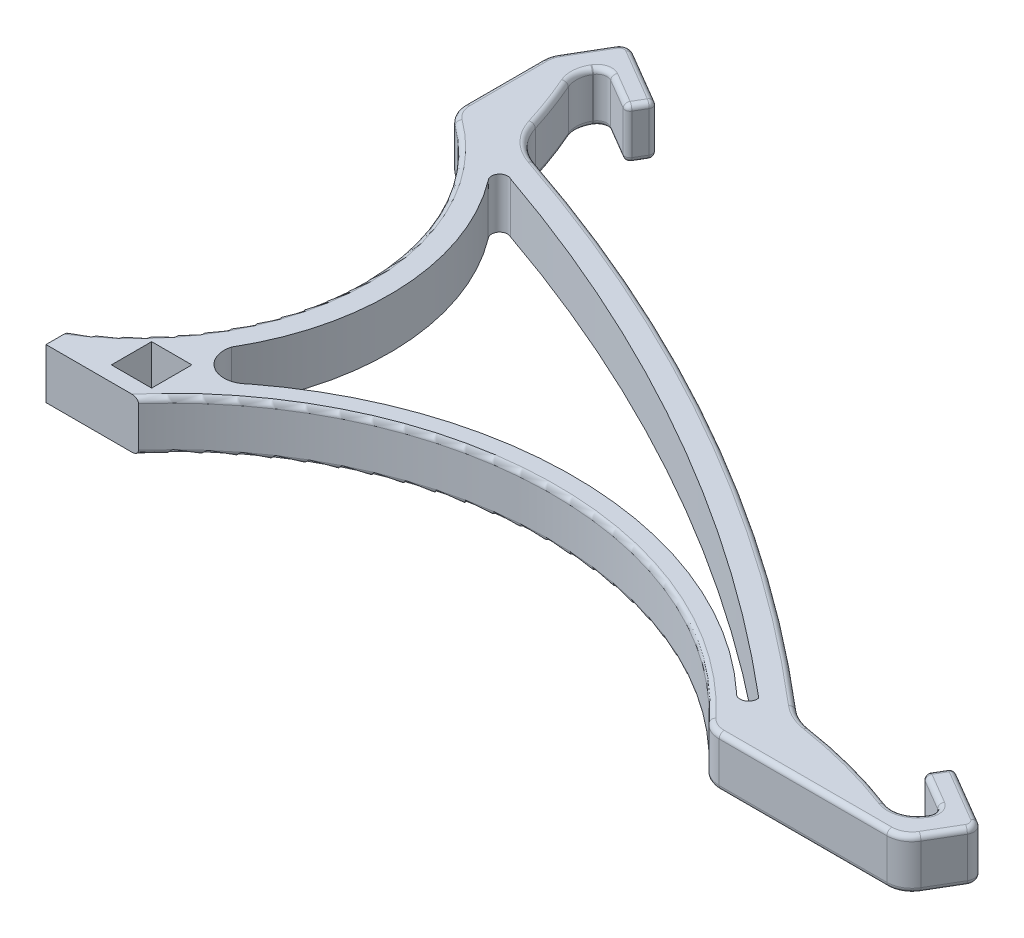
from build123d import *

# Parameters (mm, degrees)
BOSS_EXTRUDE1_DEPTH = 10
CUT_EXTRUDE1_DEPTH  = 103.530483272
BOSS_EXTRUDE3_DEPTH = 10
FILLET1_R           = 5
FILLET3_R           = 100
SKETCH4_W           = 8
SKETCH4_H           = 8
CUT_EXTRUDE2_DEPTH  = 112.808929726
FILLET4_R           = 1


with BuildPart() as part:
    # Sketch1 → Boss-Extrude1 (new body)
    with BuildSketch(Plane(origin=(0, 0, 0), x_dir=(1, 0, 0), z_dir=(0, 1, 0))):
        Polygon((-82.5, 52.5), (87.5, -47.5), (-82.5, -47.5), align=None)
    extrude(amount=BOSS_EXTRUDE1_DEPTH)

    # Sketch2 → Cut-Extrude1 (cut, through all)
    with BuildSketch(Plane(origin=(0, 10, 0), x_dir=(1, 0, 0), z_dir=(0, 1, 0))):
        with BuildLine():
            Line((-72.5, 46.617647059), (-72.5, 42.260960752))
            ThreePointArc((-72.5, 42.260960752), (-70.618090153, 36.4217303), (-65.680677547, 32.780280905))
            ThreePointArc((-65.680677547, 32.780280905), (-2.520146886, 4.604537561), (54.110121843, -35.096064577))
            ThreePointArc((54.110121843, -35.096064577), (57.142265209, -36.875274781), (60.602790692, -37.495150349))
            Line((60.602790692, -37.495150349), (70.50100103, -37.500588841))
            Line((70.50100103, -37.500588841), (-72.5, 46.617647059))
        make_face()
        with BuildLine():
            Line((49.112101066, -47.5), (-64.112101066, -47.5))
            ThreePointArc((-64.112101066, -47.5), (-7.5, -21.969013067), (49.112101066, -47.5))
        make_face()
        with BuildLine():
            Line((-82.5, -42.73498027), (-82.5, 33.203647439))
            ThreePointArc((-82.5, 33.203647439), (-62.03937094, -4.765666416), (-82.5, -42.73498027))
        make_face()
        with BuildLine():
            ThreePointArc((-55.606776415, -34.161786787), (-61.444525444, -34.944277204), (-63.616791683, -29.469529322))
            ThreePointArc((-63.616791683, -29.469529322), (-56.998023123, -1.896976683), (-66.802364381, 24.709951902))
            ThreePointArc((-66.802364381, 24.709951902), (-66.900578229, 26.780603411), (-64.870749624, 27.201363987))
            ThreePointArc((-64.870749624, 27.201363987), (-4.844619061, 0.148849816), (49.174432211, -37.493107799))
            ThreePointArc((49.174432211, -37.493107799), (48.229175402, -39.403304985), (46.162007191, -38.884480053))
            ThreePointArc((46.162007191, -38.884480053), (-3.854303198, -17.816945122), (-55.606776415, -34.161786787))
        make_face()
    extrude(amount=-CUT_EXTRUDE1_DEPTH, mode=Mode.SUBTRACT)

    # Sketch3 → Boss-Extrude3 (add, through all)
    with BuildSketch(Plane(origin=(0, 10, 0), x_dir=(1, 0, 0), z_dir=(0, 1, 0))):
        with BuildLine():
            Line((87.5, -47.5), (92.367393215, -39.225431534))
            ThreePointArc((92.367393215, -39.225431534), (92.579518581, -37.709466964), (91.657565038, -36.487522851))
            Line((91.657565038, -36.487522851), (81.314354456, -30.403281332))
            ThreePointArc((81.314354456, -30.403281332), (80.556372171, -30.297218649), (79.945400114, -30.758195421))
            Line((79.945400114, -30.758195421), (78.677849798, -32.913030959))
            ThreePointArc((78.677849798, -32.913030959), (78.571787115, -33.671013244), (79.032763886, -34.2819853))
            Line((79.032763886, -34.2819853), (85.066303392, -37.831126186))
            ThreePointArc((85.066303392, -37.831126186), (85.988256936, -39.053070299), (85.77613157, -40.56903487))
            Line((85.77613157, -40.56903487), (83.190328924, -44.964899367))
            Line((83.190328924, -44.964899367), (87.5, -47.5))
        make_face()
        with BuildLine():
            Line((-82.5, 52.5), (-77.613319152, 60.807357441))
            ThreePointArc((-77.613319152, 60.807357441), (-76.391375039, 61.729310984), (-74.875410469, 61.517185618))
            Line((-74.875410469, 61.517185618), (-64.532199887, 55.4329441))
            ThreePointArc((-64.532199887, 55.4329441), (-64.071223115, 54.821972043), (-64.177285798, 54.063989758))
            Line((-64.177285798, 54.063989758), (-65.444836115, 51.90915422))
            ThreePointArc((-65.444836115, 51.90915422), (-66.055808171, 51.448177448), (-66.813790456, 51.554240131))
            Line((-66.813790456, 51.554240131), (-72.847329962, 55.103381017))
            ThreePointArc((-72.847329962, 55.103381017), (-74.363294533, 55.315506383), (-75.585238646, 54.39355284))
            Line((-75.585238646, 54.39355284), (-78.190328924, 49.964899367))
            Line((-78.190328924, 49.964899367), (-82.5, 52.5))
        make_face()
    extrude(amount=-BOSS_EXTRUDE3_DEPTH)

    # Fillet1
    fillet1_edges = [part.edges().sort_by_distance(p)[0] for p in [
        (49.112101066, 5, 47.5),
        (-82.5, 5, -33.203647439),
        (-82.5, 5, -52.5),
        (87.5, 5, 47.5),
        (83.190328924, 5, 44.964899367),
        (-78.190328924, 5, -49.964899367),
    ]]
    fillet(fillet1_edges, radius=FILLET1_R)

    # Fillet3
    fillet3_edges = [part.edges().sort_by_distance(p)[0] for p in [
        (-72.5, 5, -46.617647059),
        (70.50100103, 5, 37.500588841),
    ]]
    fillet(fillet3_edges, radius=FILLET3_R)

    # Sketch4 → Cut-Extrude2 (cut, through all)
    with BuildSketch(Plane(origin=(0, 10, 0), x_dir=(1, 0, 0), z_dir=(0, 1, 0))):
        with Locations((-68.5, -40.5)):
            Rectangle(SKETCH4_W, SKETCH4_H)
    extrude(amount=-CUT_EXTRUDE2_DEPTH, mode=Mode.SUBTRACT)

    # Fillet4
    fillet4_edges = [part.edges().sort_by_distance(p)[0] for p in [
        (-74.363294533, 10, -55.315506383),
        (-69.830560209, 10, -53.328810574),
        (-64.811060956, 10, -52.986571989),
        (-69.703805178, 10, -58.475064859),
        (-76.391375039, 10, -61.729310984),
        (-79.711495114, 10, -57.240458306),
        (-82.5, 0, -43.473553854),
        (-82.5, 10, -43.473553854),
        (-75.620233469, 10, -54.334061642),
        (-8.570971136, 10, 21.976606221),
        (67.982036607, 10, 47.5),
        (90.65866701, 10, 42.130266084),
        (87.122657373, 10, 46.840247871),
        (49.333096697, 10, 47.086620377),
        (-82.324331839, 10, -52.452164103),
        (-81.964474926, 10, -33.557324308),
        (90.65866701, 0, 42.130266084),
        (67.982036607, 0, 47.5),
        (-8.570971136, 0, 21.976606221),
        (-75.620233469, 0, -54.334061642),
        (87.122657373, 0, 46.840247871),
        (49.333096697, 0, 47.086620377),
        (-82.324331839, 0, -52.452164103),
        (-81.964474926, 0, -33.557324308),
        (-76.336492494, 0, -52.040410074),
        (83.071447509, 10, 42.83803968),
        (-76.336492494, 10, -52.040410074),
        (69.512301706, 10, 39.540057758),
        (-73.845837143, 10, -44.577530993),
        (83.071447509, 0, 42.83803968),
        (69.512301706, 0, 39.540057758),
        (-73.845837143, 0, -44.577530993),
        (-62.056184268, 0, 6.001953724),
        (-62.056184268, 10, 6.001953724),
        (-2.520146886, 10, -4.604537561),
        (-69.654627938, 10, -35.274452391),
        (56.445754005, 0, 36.587639681),
        (-2.520146886, 0, -4.604537561),
        (-69.654627938, 0, -35.274452391),
        (56.445754005, 10, 36.587639681),
        (85.750780563, 0, 40.612131581),
        (85.988256936, 0, 39.053070299),
        (82.049533639, 0, 36.056555743),
        (79.311624956, 0, 31.83561319),
        (86.485959747, 0, 33.445402092),
        (92.579518581, 0, 37.709466964),
        (92.579518581, 10, 37.709466964),
        (86.485959747, 10, 33.445402092),
        (79.311624956, 10, 31.83561319),
        (82.049533639, 10, 36.056555743),
        (85.988256936, 10, 39.053070299),
        (85.750780563, 10, 40.612131581),
        (-79.711495114, 0, -57.240458306),
        (-76.391375039, 0, -61.729310984),
        (-69.703805178, 0, -58.475064859),
        (-64.811060956, 0, -52.986571989),
        (-69.830560209, 0, -53.328810574),
        (-74.363294533, 0, -55.315506383),
        (-66.055808171, 10, -51.448177448),
        (-64.071223115, 10, -54.821972043),
        (78.571787115, 0, 33.671013244),
        (80.556372171, 0, 30.297218649),
        (80.556372171, 10, 30.297218649),
        (78.571787115, 10, 33.671013244),
        (-64.071223115, 0, -54.821972043),
        (-66.055808171, 0, -51.448177448),
    ]]
    fillet(fillet4_edges, radius=FILLET4_R)


solid = part.part
